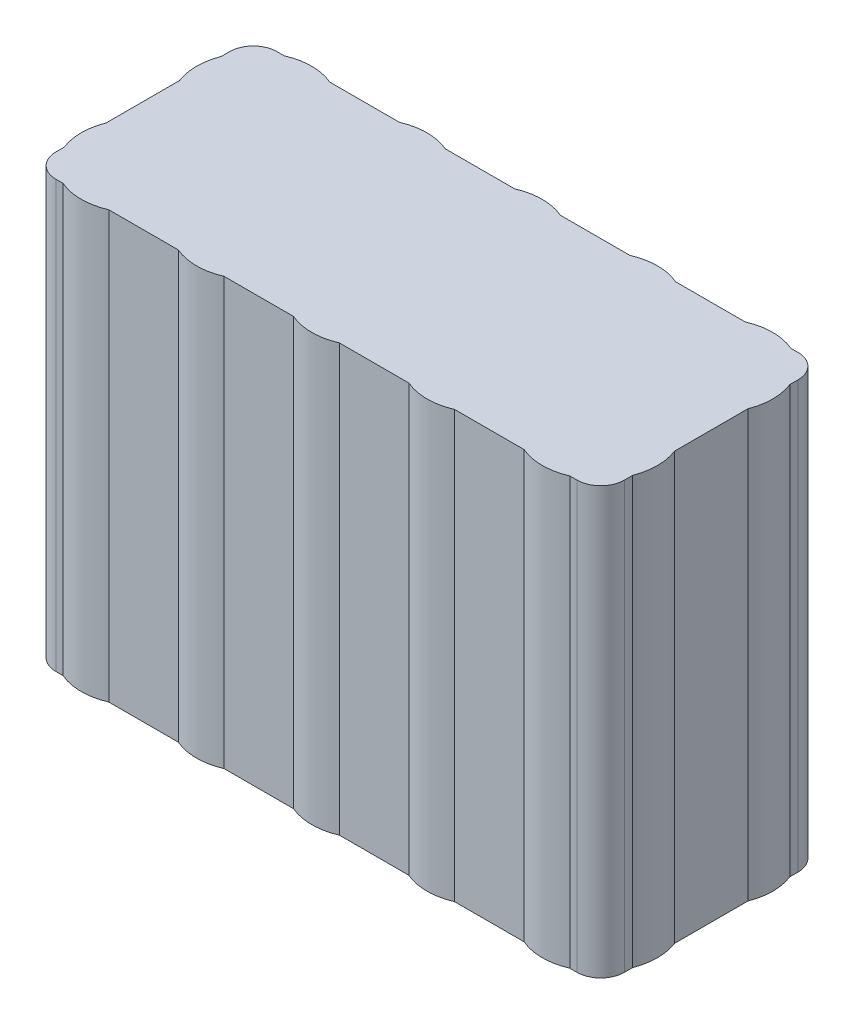
from build123d import *

# Parameters (mm, degrees)
BOSS_EXTRUDE1_DEPTH = 54


with BuildPart() as part:
    # Sketch1 → Boss-Extrude1 (new body)
    with BuildSketch(Plane(origin=(0, 0, 0), x_dir=(1, 0, 0), z_dir=(0, 1, 0))):
        with BuildLine():
            ThreePointArc((-34.630594518, -14.480554015), (-33.751914861, -16.601874359), (-31.630594518, -17.480554015))
            Line((-31.630594518, -17.480554015), (-30.728869867, -17.480554015))
            ThreePointArc((-30.728869867, -17.480554015), (-27.830594518, -18.080554015), (-24.932319169, -17.480554015))
            Line((-24.932319169, -17.480554015), (-16.128869867, -17.480554015))
            ThreePointArc((-16.128869867, -17.480554015), (-13.230594518, -18.080554015), (-10.332319169, -17.480554015))
            Line((-10.332319169, -17.480554015), (-1.528869867, -17.480554015))
            ThreePointArc((-1.528869867, -17.480554015), (1.369405482, -18.080554015), (4.267680831, -17.480554015))
            Line((4.267680831, -17.480554015), (13.071130133, -17.480554015))
            ThreePointArc((13.071130133, -17.480554015), (15.969405482, -18.080554015), (18.867680831, -17.480554015))
            Line((18.867680831, -17.480554015), (27.671130133, -17.480554015))
            ThreePointArc((27.671130133, -17.480554015), (30.569405482, -18.080554015), (33.467680831, -17.480554015))
            Line((33.467680831, -17.480554015), (34.369405482, -17.480554015))
            ThreePointArc((34.369405482, -17.480554015), (36.490725826, -16.601874359), (37.369405482, -14.480554015))
            Line((37.369405482, -14.480554015), (37.369405482, -13.435737625))
            ThreePointArc((37.369405482, -13.435737625), (37.869405482, -10.780554015), (37.369405482, -8.125370406))
            Line((37.369405482, -8.125370406), (37.369405482, 1.164262375))
            ThreePointArc((37.369405482, 1.164262375), (37.869405482, 3.819445985), (37.369405482, 6.474629594))
            Line((37.369405482, 6.474629594), (37.369405482, 7.519445985))
            ThreePointArc((37.369405482, 7.519445985), (36.490725826, 9.640766328), (34.369405482, 10.519445985))
            Line((34.369405482, 10.519445985), (33.467680831, 10.519445985))
            ThreePointArc((33.467680831, 10.519445985), (30.569405482, 11.119445985), (27.671130133, 10.519445985))
            Line((27.671130133, 10.519445985), (18.867680831, 10.519445985))
            ThreePointArc((18.867680831, 10.519445985), (15.969405482, 11.119445985), (13.071130133, 10.519445985))
            Line((13.071130133, 10.519445985), (4.267680831, 10.519445985))
            ThreePointArc((4.267680831, 10.519445985), (1.369405482, 11.119445985), (-1.528869867, 10.519445985))
            Line((-1.528869867, 10.519445985), (-10.332319169, 10.519445985))
            ThreePointArc((-10.332319169, 10.519445985), (-13.230594518, 11.119445985), (-16.128869867, 10.519445985))
            Line((-16.128869867, 10.519445985), (-24.932319169, 10.519445985))
            ThreePointArc((-24.932319169, 10.519445985), (-27.830594518, 11.119445985), (-30.728869867, 10.519445985))
            Line((-30.728869867, 10.519445985), (-31.630594518, 10.519445985))
            ThreePointArc((-31.630594518, 10.519445985), (-33.751914861, 9.640766328), (-34.630594518, 7.519445985))
            Line((-34.630594518, 7.519445985), (-34.630594518, 6.474629594))
            ThreePointArc((-34.630594518, 6.474629594), (-35.130594518, 3.819445985), (-34.630594518, 1.164262375))
            Line((-34.630594518, 1.164262375), (-34.630594518, -8.125370406))
            ThreePointArc((-34.630594518, -8.125370406), (-35.130594518, -10.780554015), (-34.630594518, -13.435737625))
            Line((-34.630594518, -13.435737625), (-34.630594518, -14.480554015))
        make_face()
    extrude(amount=BOSS_EXTRUDE1_DEPTH)


solid = part.part
